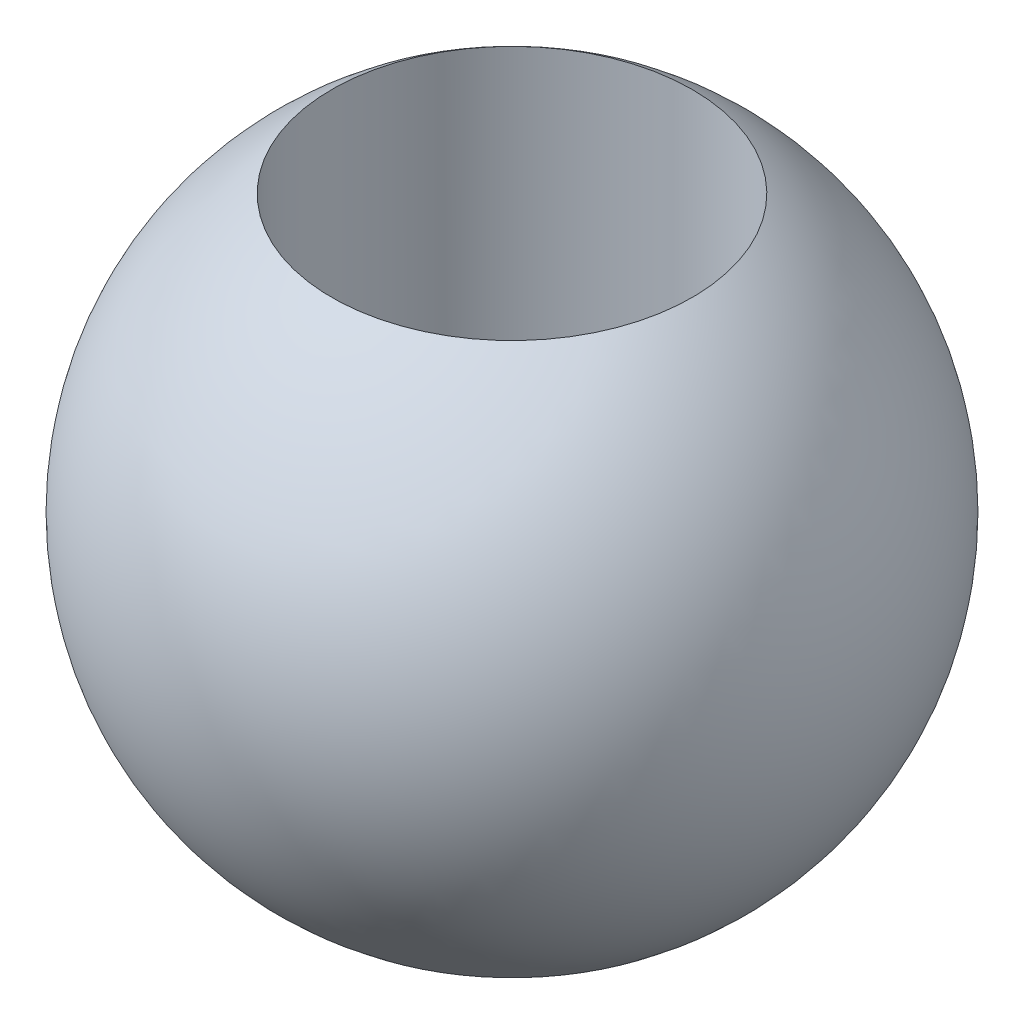
from build123d import *

# Parameters (mm, degrees)
CUT_EXTRUDE1_DEPTH      = 6.542562584
CUT_EXTRUDE1_DEPTH_BACK = 6.542562584
SKETCH2_R               = 1.75


with BuildPart() as part:
    # Sketch1 → Revolve1 (revolve)
    with BuildSketch(Plane.XY):
        with BuildLine():
            Line((-3.2, 0), (3.2, 0))
            ThreePointArc((3.2, 0), (0, 3.2), (-3.2, 0))
        make_face()
    revolve(axis=Axis((-3.2, 0, 0), (1, 0, 0)))

    # Sketch2 → Cut-Extrude1 (cut, two sides: drawn at the far end of the back side and taken through both)
    with BuildSketch(Plane(origin=(0, 0, 0), x_dir=(1, 0, 0), z_dir=(0, 1, 0)).offset(-CUT_EXTRUDE1_DEPTH_BACK)):
        with Locations(Location((0, 0, 0), (0, 0, 90))):
            Circle(SKETCH2_R)
    extrude(amount=CUT_EXTRUDE1_DEPTH + CUT_EXTRUDE1_DEPTH_BACK, mode=Mode.SUBTRACT)


solid = part.part
